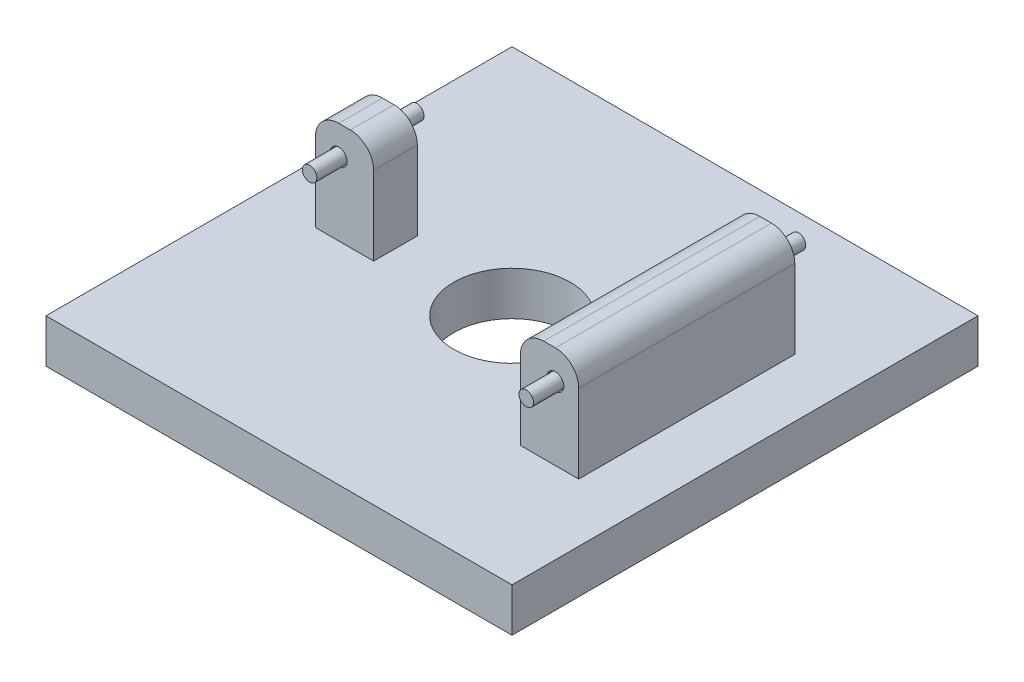
from build123d import *

# Parameters (mm, degrees)
SKETCH3_W                = 50.8
SKETCH3_H                = 50.8
BOSS_EXTRUDE2_DEPTH      = 4.7625
SKETCH4_R                = 6.35
CUT_EXTRUDE2_DEPTH       = 37.235361268
SKETCH5_W                = 6.35
SKETCH5_H                = 4.7625
SKETCH5_H_2              = 23.5585
BOSS_EXTRUDE3_DEPTH      = 11.1125
CUT_EXTRUDE5_DEPTH       = 41.853071813
CUT_EXTRUDE5_DEPTH_BACK  = 41.853071813
SKETCH8_R                = 0.79375
SKETCH8_R_2              = 0.92075
BOSS_EXTRUDE5_DEPTH      = 3.175
BOSS_EXTRUDE5_DEPTH_BACK = 8.509
SKETCH9_R                = 0.79375
CUT_EXTRUDE6_START       = -23.5585
SKETCH10_R               = 0.92075
CUT_EXTRUDE6_DEPTH       = 23.5585
BOSS_EXTRUDE6_DEPTH      = 3.175
BOSS_EXTRUDE6_DEPTH_BACK = 26.500160894
SKETCH11_R               = 0.79375
FILLET1_R                = 2.54


with BuildPart() as part:
    # Sketch3 → Boss-Extrude2 (new body)
    with BuildSketch(Plane(origin=(0, 0, 0), x_dir=(1, 0, 0), z_dir=(0, 1, 0))):
        Rectangle(SKETCH3_W, SKETCH3_H)
    extrude(amount=BOSS_EXTRUDE2_DEPTH)

    # Sketch4 → Cut-Extrude2 (cut, through all)
    with BuildSketch(Plane(origin=(0, 4.7625, 0), x_dir=(1, 0, 0), z_dir=(0, 1, 0))):
        with Locations(Location((0, 0, 0), (0, 0, 270))):
            Circle(SKETCH4_R)
    extrude(amount=-CUT_EXTRUDE2_DEPTH, mode=Mode.SUBTRACT)

    # Sketch5 → Boss-Extrude3 (add)
    with BuildSketch(Plane(origin=(0, 4.7625, 0), x_dir=(1, 0, 0), z_dir=(0, 1, 0))):
        with Locations((-15.875, 0)):
            Rectangle(SKETCH5_W, SKETCH5_H)
        with Locations((15.875, 0)):
            Rectangle(SKETCH5_W, SKETCH5_H_2)
    extrude(amount=BOSS_EXTRUDE3_DEPTH)

    # Sketch8 → Cut-Extrude5 (cut, two sides: drawn at the far end of the back side and taken through both)
    with BuildSketch(Plane.XY.offset(2.38125).offset(-CUT_EXTRUDE5_DEPTH_BACK)):
        with Locations((16.51, 12.7)):
            Circle(SKETCH8_R)
        with Locations((-16.51, 12.7)):
            Circle(SKETCH8_R_2)
    extrude(amount=CUT_EXTRUDE5_DEPTH + CUT_EXTRUDE5_DEPTH_BACK, mode=Mode.SUBTRACT)

    # Sketch9 → Boss-Extrude5 (add, two sides: drawn at the far end of the back side and taken through both)
    with BuildSketch(Plane.XY.offset(2.38125).offset(-BOSS_EXTRUDE5_DEPTH_BACK)):
        with Locations((-16.51, 12.7)):
            Circle(SKETCH9_R)
        with Locations((16.51, 12.7)):
            Circle(SKETCH9_R)
    extrude(amount=BOSS_EXTRUDE5_DEPTH + BOSS_EXTRUDE5_DEPTH_BACK)


with BuildPart() as boss_extrude5_piece_1:
    # of the separate pieces the step leaves, piece 1, a body of its own (boss_extrude5_pieces)
    add(part.part.solids().sort_by_distance((-25.4, 0, -25.4))[0])

    # Sketch10 → Cut-Extrude6 (cut)
    with BuildSketch(Plane.XY.offset(11.77925).offset(CUT_EXTRUDE6_START)):
        with Locations((16.51, 12.7)):
            Circle(SKETCH10_R)
    extrude(amount=CUT_EXTRUDE6_DEPTH, mode=Mode.SUBTRACT)

    # Fillet1
    fillet1_edges = [boss_extrude5_piece_1.edges().sort_by_distance(p)[0] for p in [
        (-19.05, 15.875, 0),
        (-12.7, 15.875, 0),
        (19.05, 15.875, 0),
        (12.7, 15.875, 0),
    ]]
    fillet(fillet1_edges, radius=FILLET1_R)


with BuildPart() as boss_extrude5_piece_2:
    # of the separate pieces the step leaves, piece 2, a body of its own (boss_extrude5_pieces)
    add(part.part.solids().sort_by_distance((-15.71625, 12.7, 2.38125))[0])


with BuildPart() as body_3:
    # Sketch11 → Boss-Extrude6 (new, two sides: drawn at the far end of the back side and taken through both)
    with BuildSketch(Plane.XY.offset(11.77925).offset(-BOSS_EXTRUDE6_DEPTH_BACK)):
        with Locations((16.51, 12.7)):
            Circle(SKETCH11_R)
    extrude(amount=BOSS_EXTRUDE6_DEPTH + BOSS_EXTRUDE6_DEPTH_BACK)


solid = Compound([boss_extrude5_piece_1.part, boss_extrude5_piece_2.part, body_3.part])
